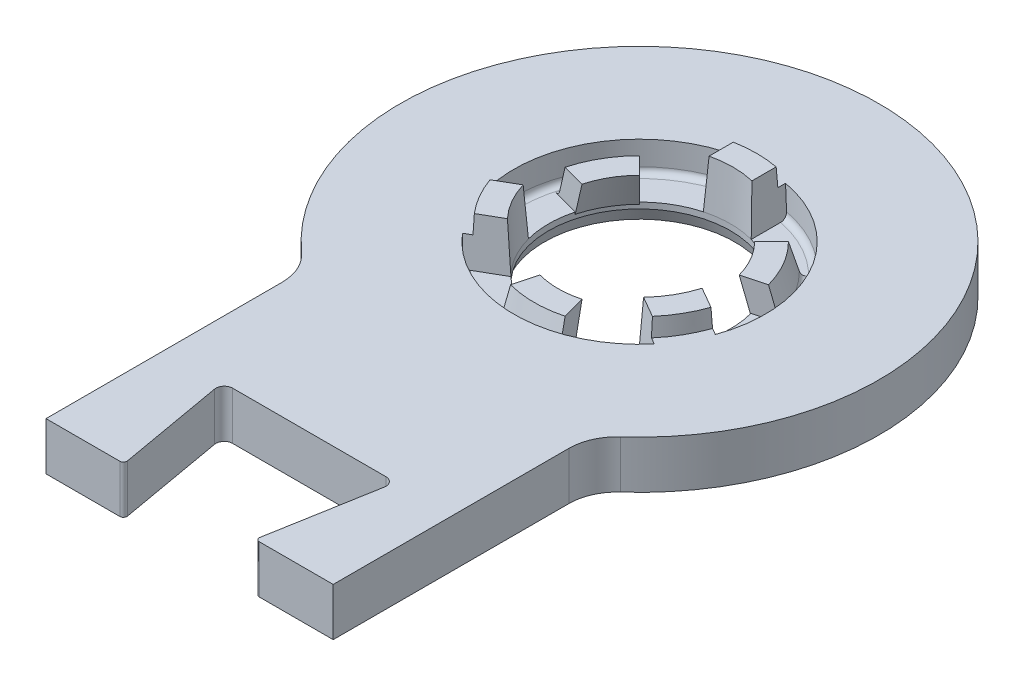
from build123d import *

# Parameters (mm, degrees)
SKETCH1_R                = 4
BOSS_EXTRUDE1_DEPTH      = 2
SKETCH2_R                = 10
SKETCH2_R_2              = 3.8
BOSS_EXTRUDE2_DEPTH      = 2
SKETCH4_W                = 12
SKETCH4_H                = 0.2
CUT_EXTRUDE1_DEPTH       = 4
FILLET3_R                = 0.35
FILLET4_R                = 0.15
FILLET6_R                = 2
SKETCH13_R               = 5.25
CUT_EXTRUDE5_DEPTH       = 1.25
REVOLVE2_ANGLE           = 30
CIRPATTERN2_COUNT        = 3
CHAMFER1_SIZE            = 0.5
CHAMFER1_SIZE2           = 0.181985117
FILLET14_R               = 0.25
BOSS_EXTRUDE8_START      = -0.75
BOSS_EXTRUDE8_DEPTH      = 2
BOSS_EXTRUDE8_DRAFT      = -3
SKETCH16_W               = 2
SKETCH16_H               = 1.934959958
BOSS_EXTRUDE9_DEPTH      = 1.25
BOSS_EXTRUDE9_TAPER      = 3
CIRPATTERN3_COUNT        = 3
CIRPATTERN3_START        = -0.75
CIRPATTERN3_COPY_1_DEPTH = 2
CIRPATTERN3_COPY_1_DRAFT = -3
CIRPATTERN3_COPY_2_DEPTH = 2
CIRPATTERN3_COPY_2_DRAFT = -3


with BuildPart() as part:
    # Sketch1 → Boss-Extrude1 (new body)
    with BuildSketch(Plane(origin=(0, 0, 0), x_dir=(1, 0, 0), z_dir=(0, 1, 0))):
        Polygon((-6, 6), (-6, -13.291502622), (-6, -19), (-2.70227506, -19), (-3.619175359, -13.8), (0, -13.8), (3.619175359, -13.8), (2.70227506, -19), (6, -19), (6, -13.291502622), (6, 6), align=None)
        with Locations(Location((0, 0, 0), (0, 0, 270))):
            Circle(SKETCH1_R, mode=Mode.SUBTRACT)
    extrude(amount=BOSS_EXTRUDE1_DEPTH)

    # Sketch2 → Boss-Extrude2 (add)
    with BuildSketch(Plane(origin=(0, 0, 0), x_dir=(1, 0, 0), z_dir=(0, 1, 0))):
        Circle(SKETCH2_R)
        with Locations(Location((0, 0, 0), (0, 0, 270))):
            Circle(SKETCH2_R_2, mode=Mode.SUBTRACT)
    extrude(amount=BOSS_EXTRUDE2_DEPTH)

    # Sketch4 → Cut-Extrude1 (cut)
    with BuildSketch(Plane(origin=(0, 2, 0), x_dir=(1, 0, 0), z_dir=(0, 1, 0))):
        with Locations((0, -18.9)):
            Rectangle(SKETCH4_W, SKETCH4_H)
    extrude(amount=-CUT_EXTRUDE1_DEPTH, mode=Mode.SUBTRACT)

    # Fillet3
    fillet3_edges = [part.edges().sort_by_distance(p)[0] for p in [
        (3.619175359, 1, 13.8),
        (-3.619175359, 1, 13.8),
    ]]
    fillet(fillet3_edges, radius=FILLET3_R)

    # Fillet4
    fillet4_edges = [part.edges().sort_by_distance(p)[0] for p in [
        (2.737540456, 1, 18.8),
        (-2.737540456, 1, 18.8),
    ]]
    fillet(fillet4_edges, radius=FILLET4_R)

    # Fillet6
    fillet6_edges = [part.edges().sort_by_distance(p)[0] for p in [
        (6, 1, 8),
        (-6, 1, 8),
    ]]
    fillet(fillet6_edges, radius=FILLET6_R)

    # Sketch13 → Cut-Extrude5 (cut)
    with BuildSketch(Plane(origin=(0, 2, 0), x_dir=(1, 0, 0), z_dir=(0, 1, 0))):
        with Locations(Location((0, 0, 0), (0, 0, 270))):
            Circle(SKETCH13_R)
    extrude(amount=-CUT_EXTRUDE5_DEPTH, mode=Mode.SUBTRACT)

    # Sketch12 → Revolve2 (revolve, symmetric)
    with BuildSketch(Plane(origin=(0, 0, 0), x_dir=(0, 0, -1), z_dir=(1, 0, 0))) as revolve2_sk:
        Polygon((-4, 0), (-3.4, 2), (-4.4, 2), (-5, 0), align=None)
    revolve2 = revolve(axis=Axis((0, 0, 0), (0, 1, 0)), revolution_arc=REVOLVE2_ANGLE / 2)
    revolve2 = revolve2 + revolve(revolve2_sk.sketch, axis=Axis((0, 0, 0), (0, -1, 0)), revolution_arc=REVOLVE2_ANGLE / 2)

    # CirPattern2: Revolve2 ×3 about axis
    cirpattern2_axis = Axis((0, 0, 0), (0, 1, 0))
    for i in range(1, CIRPATTERN2_COUNT):
        add(revolve2.rotate(cirpattern2_axis, i * 360 / CIRPATTERN2_COUNT))

    # Chamfer1
    chamfer1_edges = [part.edges().sort_by_distance(p)[0] for p in [
        (0, 0, -3.8),
    ]]
    chamfer1_side = [part.faces().sort_by_distance(p)[0] for p in [
        (0, 0.375, -3.8),
    ]]
    chamfer(chamfer1_edges, length=CHAMFER1_SIZE, length2=CHAMFER1_SIZE2, reference=chamfer1_side[0])

    # Fillet14
    fillet14_edges = [part.edges().sort_by_distance(p)[0] for p in [
        (0, 0.75, -5.25),
        (0, 0.75, 4.775),
        (-4.135271303, 0.75, -2.3875),
        (4.135271303, 0.75, -2.3875),
    ]]
    fillet(fillet14_edges, radius=FILLET14_R)


with BuildPart() as boss_extrude8_tool:
    # Sketch15 → Boss-Extrude8 (with draft: the straight prism first)
    with BuildSketch(Plane.XZ.offset(BOSS_EXTRUDE8_START)):
        with BuildLine():
            Line((1, -4.898979486), (1, -3.666060556))
            ThreePointArc((1, -3.666060556), (0, -3.8), (-1, -3.666060556))
            Line((-1, -3.666060556), (-1, -4.898979486))
            ThreePointArc((-1, -4.898979486), (0, -5), (1, -4.898979486))
        make_face()
    extrude(amount=-BOSS_EXTRUDE8_DEPTH)
    # Boss-Extrude8: the draft: its side faces are tilted about the plane it starts from
    boss_extrude8_sides = [boss_extrude8_tool.faces().sort_by_distance(p)[0] for p in [
        (1, 1.75, -4.282520021),
        (0, 1.75, -3.8),
        (-1, 1.75, -4.282520021),
        (0, 1.75, -5),
    ]]
    draft(boss_extrude8_sides, Plane.XZ.offset(BOSS_EXTRUDE8_START), BOSS_EXTRUDE8_DRAFT)


with BuildPart() as part_1:
    add(part.part)

    # Boss-Extrude8: add boss_extrude8_tool
    add(boss_extrude8_tool.part)

    # Sketch16 → Boss-Extrude9 (add)
    with BuildSketch(Plane(origin=(0, 0.75, 0), x_dir=(1, 0, 0), z_dir=(0, 1, 0))):
        with Locations((0, 5.25)):
            Rectangle(SKETCH16_W, SKETCH16_H)
    boss_extrude9 = extrude(amount=BOSS_EXTRUDE9_DEPTH, taper=BOSS_EXTRUDE9_TAPER)

    # CirPattern3: Boss-Extrude9 ×3 about axis
    cirpattern3_axis = Axis((0, 0, 0), (0, 1, 0))
    for i in range(1, CIRPATTERN3_COUNT):
        add(boss_extrude9.rotate(cirpattern3_axis, i * 360 / CIRPATTERN3_COUNT))


with BuildPart() as cirpattern3_copy_1_tool:
    # CirPattern3 copy 1 sketch → CirPattern3 copy 1 (with draft: the straight prism first)
    with BuildSketch(Plane(origin=(0, 0, 0), x_dir=(-0.4999999999999998, 0, -0.8660254037844387), z_dir=(0, -1, 0)).offset(CIRPATTERN3_START)):
        with BuildLine():
            Line((1, -4.898979486), (1, -3.666060556))
            ThreePointArc((1, -3.666060556), (0, -3.8), (-1, -3.666060556))
            Line((-1, -3.666060556), (-1, -4.898979486))
            ThreePointArc((-1, -4.898979486), (0, -5), (1, -4.898979486))
        make_face()
    extrude(amount=-CIRPATTERN3_COPY_1_DEPTH)
    # CirPattern3 copy 1: the draft: its side faces are tilted about the plane it starts from
    cirpattern3_copy_1_sides = [cirpattern3_copy_1_tool.faces().sort_by_distance(p)[0] for p in [
        (-4.20877113, 1.75, 1.275234607),
        (-3.290896534, 1.75, 1.9),
        (-3.20877113, 1.75, 3.007285414),
        (-4.330127019, 1.75, 2.5),
    ]]
    draft(cirpattern3_copy_1_sides, Plane(origin=(0, 0, 0), x_dir=(-0.4999999999999998, 0, -0.8660254037844387), z_dir=(0, -1, 0)).offset(CIRPATTERN3_START), CIRPATTERN3_COPY_1_DRAFT)


with BuildPart() as part_2:
    add(part_1.part)

    # CirPattern3 copy 1: add cirpattern3_copy_1_tool
    add(cirpattern3_copy_1_tool.part)


with BuildPart() as cirpattern3_copy_2_tool:
    # CirPattern3 copy 2 sketch → CirPattern3 copy 2 (with draft: the straight prism first)
    with BuildSketch(Plane(origin=(0, 0, 0), x_dir=(-0.5000000000000004, 0, 0.8660254037844384), z_dir=(0, -1, 0)).offset(CIRPATTERN3_START)):
        with BuildLine():
            Line((1, -4.898979486), (1, -3.666060556))
            ThreePointArc((1, -3.666060556), (0, -3.8), (-1, -3.666060556))
            Line((-1, -3.666060556), (-1, -4.898979486))
            ThreePointArc((-1, -4.898979486), (0, -5), (1, -4.898979486))
        make_face()
    extrude(amount=-CIRPATTERN3_COPY_2_DEPTH)
    # CirPattern3 copy 2: the draft: its side faces are tilted about the plane it starts from
    cirpattern3_copy_2_sides = [cirpattern3_copy_2_tool.faces().sort_by_distance(p)[0] for p in [
        (3.20877113, 1.75, 3.007285414),
        (3.290896534, 1.75, 1.9),
        (4.20877113, 1.75, 1.275234607),
        (4.330127019, 1.75, 2.5),
    ]]
    draft(cirpattern3_copy_2_sides, Plane(origin=(0, 0, 0), x_dir=(-0.5000000000000004, 0, 0.8660254037844384), z_dir=(0, -1, 0)).offset(CIRPATTERN3_START), CIRPATTERN3_COPY_2_DRAFT)


with BuildPart() as part_3:
    add(part_2.part)

    # CirPattern3 copy 2: add cirpattern3_copy_2_tool
    add(cirpattern3_copy_2_tool.part)


solid = part_3.part
